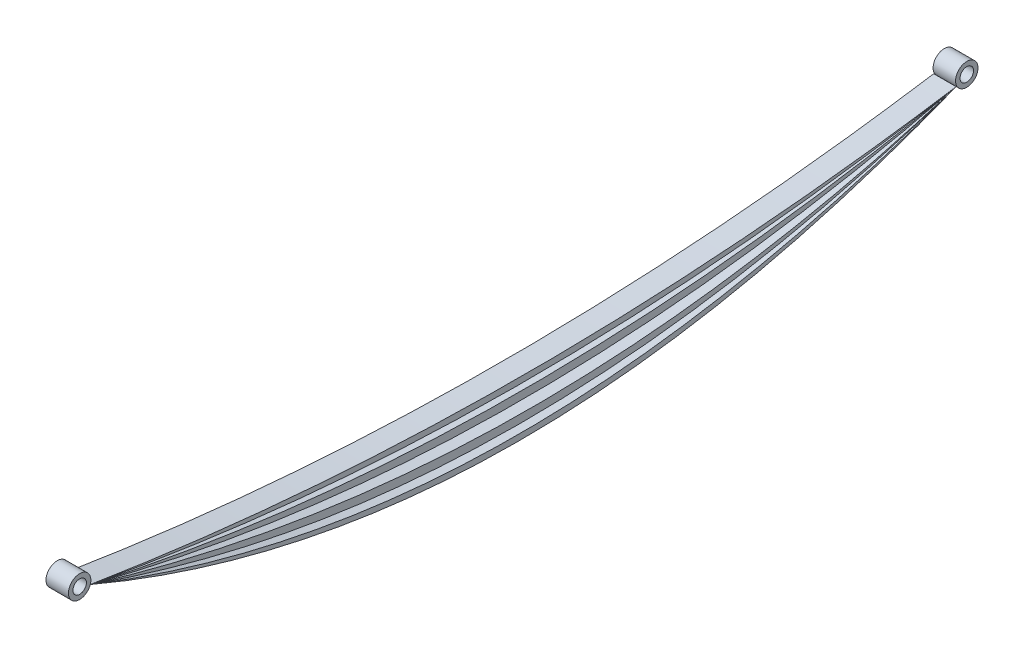
from build123d import *

# Parameters (mm, degrees)
SKETCH1_R             = 2.5
BOSS_EXTRUDE3_DEPTH   = 5
BOSS_EXTRUDE3_2_DEPTH = 5
BOSS_EXTRUDE3_3_DEPTH = 5
BOSS_EXTRUDE3_4_DEPTH = 5
BOSS_EXTRUDE3_5_DEPTH = 5
BOSS_EXTRUDE3_6_DEPTH = 5
SKETCH3_R             = 1.5
CUT_EXTRUDE2_DEPTH    = 5
SKETCH4_R             = 1.5
CUT_EXTRUDE3_DEPTH    = 5


with BuildPart() as part:
    # Sketch1 → Boss-Extrude3 (new body)
    with BuildSketch(Plane(origin=(0, 0, 0), x_dir=(0, 0, -1), z_dir=(1, 0, 0))):
        with Locations((-130.152152052, 43.261372857)):
            Circle(SKETCH1_R)
    extrude(amount=BOSS_EXTRUDE3_DEPTH)

    # Sketch4 → Cut-Extrude3 (cut)
    with BuildSketch(Plane.ZY):
        with Locations((130.152152052, 43.261372857)):
            Circle(SKETCH4_R)
    extrude(amount=-CUT_EXTRUDE3_DEPTH, mode=Mode.SUBTRACT)


with BuildPart() as body_2:
    # Sketch1 → Boss-Extrude3 2 (new body)
    with BuildSketch(Plane(origin=(0, 0, 0), x_dir=(0, 0, -1), z_dir=(1, 0, 0))):
        with Locations((67.430455083, 43.261372857)):
            Circle(SKETCH1_R)
    extrude(amount=BOSS_EXTRUDE3_2_DEPTH)

    # Sketch3 → Cut-Extrude2 (cut)
    with BuildSketch(Plane(origin=(5, 0, 0), x_dir=(0, 0, -1), z_dir=(1, 0, 0))):
        with Locations((67.430455083, 43.261372857)):
            Circle(SKETCH3_R)
    extrude(amount=-CUT_EXTRUDE2_DEPTH, mode=Mode.SUBTRACT)


with BuildPart() as body_3:
    # Sketch1 → Boss-Extrude3 3 (new body)
    with BuildSketch(Plane(origin=(0, 0, 0), x_dir=(0, 0, -1), z_dir=(1, 0, 0))):
        with BuildLine():
            add(Edge.make_bspline(
                [(-127.780848485, 42.469590443), (-31.755358337, 26.970318458), (65.059151515, 42.080014685)],
                knots=[0, 0, 0, 1, 1, 1], degree=2))
            add(Edge.make_bspline(
                [(-127.780848485, 42.469590443), (-32.196029377, 24.242932654), (65.059151515, 42.080014685)],
                knots=[0, 0, 0, 1, 1, 1], degree=2))
        make_face()
    extrude(amount=BOSS_EXTRUDE3_3_DEPTH)


with BuildPart() as body_4:
    # Sketch1 → Boss-Extrude3 4 (new body)
    with BuildSketch(Plane(origin=(0, 0, 0), x_dir=(0, 0, -1), z_dir=(1, 0, 0))):
        with BuildLine():
            add(Edge.make_bspline(
                [(-127.780848485, 42.469590443), (-32.79082066, 21.343949998), (65.059151515, 42.080014685)],
                knots=[0, 0, 0, 1, 1, 1], degree=2))
            add(Edge.make_bspline(
                [(-127.780848485, 42.469590443), (-32.333202084, 17.790684743), (65.059151515, 42.080014685)],
                knots=[0, 0, 0, 1, 1, 1], degree=2))
        make_face()
    extrude(amount=BOSS_EXTRUDE3_4_DEPTH)


with BuildPart() as body_5:
    # Sketch1 → Boss-Extrude3 5 (new body)
    with BuildSketch(Plane(origin=(0, 0, 0), x_dir=(0, 0, -1), z_dir=(1, 0, 0))):
        with BuildLine():
            add(Edge.make_bspline(
                [(-127.780848485, 42.469590443), (-33.152715368, 9.047484995), (65.059151515, 42.080014685)],
                knots=[0, 0, 0, 1, 1, 1], degree=2))
            add(Edge.make_bspline(
                [(65.059151515, 42.080014685), (-28.672265267, 12.592276626), (-127.780848485, 42.469590443)],
                knots=[0, 0, 0, 1, 1, 1], degree=2))
        make_face()
    extrude(amount=BOSS_EXTRUDE3_5_DEPTH)


with BuildPart() as body_6:
    # Sketch1 → Boss-Extrude3 6 (new body)
    with BuildSketch(Plane(origin=(0, 0, 0), x_dir=(0, 0, -1), z_dir=(1, 0, 0))):
        with BuildLine():
            add(Edge.make_bspline(
                [(-127.780848485, 42.469590443), (-33.812268468, 2.597675449), (65.059151515, 42.080014685)],
                knots=[0, 0, 0, 1, 1, 1], degree=2))
            add(Edge.make_bspline(
                [(65.059151515, 42.080014685), (2.955658013, 19.142565321), (-60.748951765, 16.051405144), (-127.780848485, 42.469590443)],
                knots=[0, 0, 0, 0, 1, 1, 1, 1], degree=3))
        make_face()
    extrude(amount=BOSS_EXTRUDE3_6_DEPTH)


solid = Compound([part.part, body_2.part, body_3.part, body_4.part, body_5.part, body_6.part])
